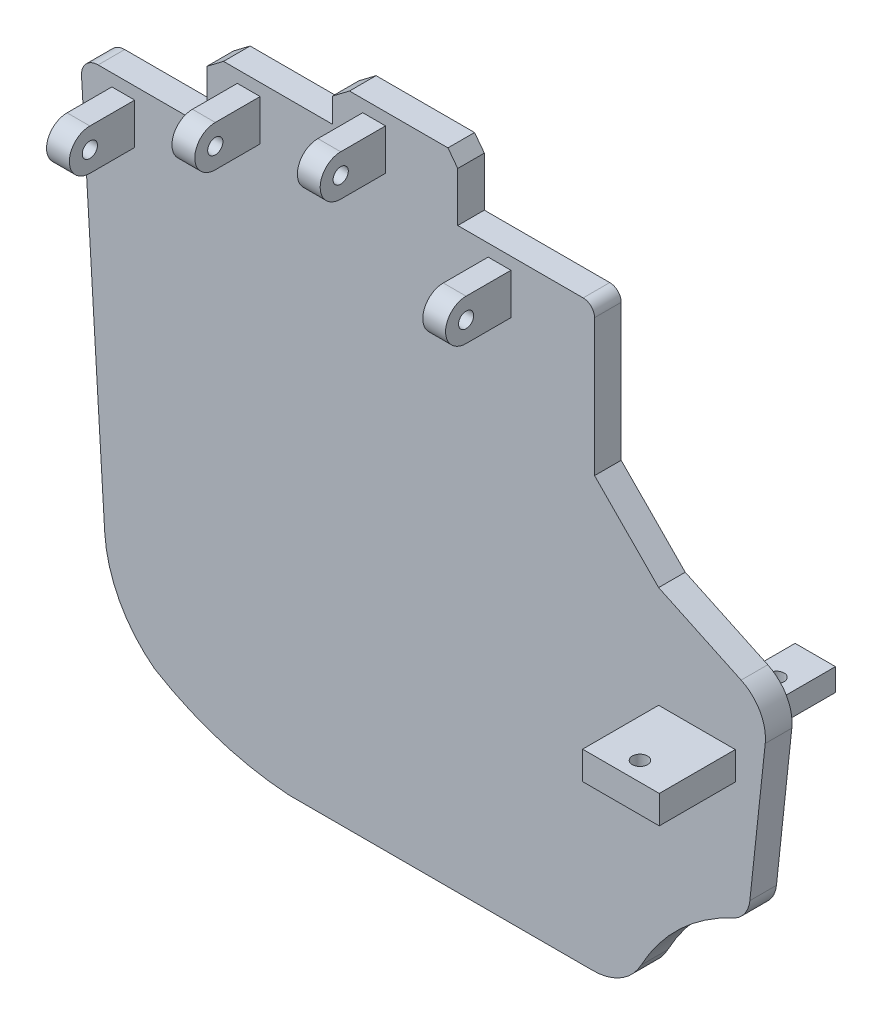
from build123d import *

# Parameters (mm, degrees)
BOSS_EXTRUDE1_DEPTH   = 3.5
SKETCH2_W             = 3
SKETCH2_H             = 5.4
BOSS_EXTRUDE2_DEPTH   = 8.6
BOSS_EXTRUDE2_2_DEPTH = 8.6
BOSS_EXTRUDE2_3_DEPTH = 8.6
BOSS_EXTRUDE2_4_DEPTH = 8.6
FILLET1_RADIUS        = 2.7
FILLET1_LENGTH        = 3
SKETCH3_R             = 1
CUT_EXTRUDE1_DEPTH    = 8.6
FILLET2_RADIUS        = 2.7
FILLET2_LENGTH        = 3
FILLET3_RADIUS        = 2.7
FILLET3_LENGTH        = 3
FILLET4_RADIUS        = 2.7
FILLET4_LENGTH        = 3
SKETCH4_R             = 1
CUT_EXTRUDE2_DEPTH    = 8.6
SKETCH5_R             = 1
CUT_EXTRUDE3_DEPTH    = 8.6
SKETCH6_R             = 1
CUT_EXTRUDE4_DEPTH    = 8.6
SKETCH7_W             = 10.088041161
SKETCH7_H             = 3.698948425
BOSS_EXTRUDE3_DEPTH   = 10
SKETCH9_W             = 5.309014269
SKETCH9_H             = 2.949452372
BOSS_EXTRUDE4_DEPTH   = 10
SKETCH10_R            = 1
CUT_EXTRUDE5_DEPTH    = 80.588500555
SKETCH11_R            = 1
CUT_EXTRUDE6_DEPTH    = 36


with BuildPart() as part:
    # Sketch1 → Boss-Extrude1 (new body)
    with BuildSketch(Plane.XY):
        with BuildLine():
            Line((0, 0), (40, 0))
            ThreePointArc((40, 0), (43.702860631, 1.02313584), (46.355122404, 3.802252838))
            ThreePointArc((46.355122404, 3.802252838), (51.476523904, 10.489381564), (58.451995118, 15.210530288))
            ThreePointArc((58.451995118, 15.210530288), (59.958649091, 16.457862213), (60.65507251, 18.285658031))
            Line((60.65507251, 18.285658031), (62.676036693, 37.205672289))
            ThreePointArc((62.676036693, 37.205672289), (61.992272805, 40.530891279), (59.507328539, 42.843825863))
            Line((59.507328539, 42.843825863), (48.652081527, 47.958863722))
            Line((48.652081527, 47.958863722), (40.223025169, 56.5))
            Line((40.223025169, 56.5), (40.223025169, 74.5))
            ThreePointArc((40.223025169, 74.5), (39.783685341, 75.560660172), (38.723025169, 76))
            Line((38.723025169, 76), (22.223025169, 76))
            Line((22.223025169, 76), (22.223025169, 82.5))
            Line((22.223025169, 82.5), (20.933955052, 84.202172899))
            Line((20.933955052, 84.202172899), (7.977740221, 84.202172899))
            Line((7.977740221, 84.202172899), (5.723025169, 82.494657876))
            Line((5.723025169, 82.494657876), (5.723025169, 79.294657876))
            Line((5.723025169, 79.294657876), (-8.593770284, 79.294657876))
            Line((-8.593770284, 79.294657876), (-10.776974831, 77.641298372))
            Line((-10.776974831, 77.641298372), (-10.776974831, 70.641298372))
            Line((-10.776974831, 70.641298372), (-25.093770284, 70.641298372))
            ThreePointArc((-25.093770284, 70.641298372), (-26.686352367, 69.953270921), (-27.276974831, 68.32205525))
            Line((-27.276974831, 68.32205525), (-24.222625674, 17.823537539))
            ThreePointArc((-24.222625674, 17.823537539), (-22.27885064, 10.959272595), (-17.644671543, 5.535180163))
            ThreePointArc((-17.644671543, 5.535180163), (-9.153938091, 1.710530722), (0, 0))
        make_face()
    extrude(amount=BOSS_EXTRUDE1_DEPTH)

    # Sketch7 → Boss-Extrude3 (add)
    with BuildSketch(Plane.XY.offset(3.5)):
        with Locations((53.693991646, 32.699391902)):
            Rectangle(SKETCH7_W, SKETCH7_H)
    extrude(amount=BOSS_EXTRUDE3_DEPTH)

    # Sketch9 → Boss-Extrude4 (add)
    with BuildSketch(Plane(origin=(0, 0, 0), x_dir=(-1, 0, 0), z_dir=(0, 0, -1))):
        with Locations((-55.761247102, 35.612291232)):
            Rectangle(SKETCH9_W, SKETCH9_H)
    extrude(amount=BOSS_EXTRUDE4_DEPTH)

    # Sketch10 → Cut-Extrude5 (cut, through all)
    with BuildSketch(Plane(origin=(0, 37.087017418, 0), x_dir=(1, 0, 0), z_dir=(0, 1, 0))):
        with Locations(Location((55.761247101, 4.9, 0), (0, 0, 270))):
            Circle(SKETCH10_R)
    extrude(amount=-CUT_EXTRUDE5_DEPTH, mode=Mode.SUBTRACT)

    # Sketch11 → Cut-Extrude6 (cut)
    with BuildSketch(Plane(origin=(0, 34.548866114, 0), x_dir=(1, 0, 0), z_dir=(0, 1, 0))):
        with Locations(Location((53.693991645, -11, 0), (0, 0, 270))):
            Circle(SKETCH11_R)
    extrude(amount=-CUT_EXTRUDE6_DEPTH, mode=Mode.SUBTRACT)


with BuildPart() as body_2:
    # Sketch2 → Boss-Extrude2 (new body)
    with BuildSketch(Plane.XY.offset(3.5)):
        with Locations((-21.776974831, 66.341298372)):
            Rectangle(SKETCH2_W, SKETCH2_H)
    extrude(amount=BOSS_EXTRUDE2_DEPTH)

    # Fillet1: full round fillet: the end face becomes a half cylinder, R = half its width
    fillet1_face = Plane((-21.776974831, 66.341298372, 12.1), x_dir=(-1, 0, 0), z_dir=(0, 0, 1))  # on the end face: x along it, z out of the body
    fillet1_slab = fillet1_face.offset(-FILLET1_RADIUS / 2) * Box(FILLET1_LENGTH, 2 * FILLET1_RADIUS, FILLET1_RADIUS, mode=Mode.PRIVATE)  # the body's end, R deep
    fillet1_round = Plane((-21.776974831, 66.341298372, 9.4), x_dir=(0, 0, 1), z_dir=(-1, 0, 0)) * Cylinder(FILLET1_RADIUS, FILLET1_LENGTH, mode=Mode.PRIVATE)  # its axis R under the face
    add(fillet1_slab - fillet1_round, mode=Mode.SUBTRACT)

    # Sketch3 → Cut-Extrude1 (cut)
    with BuildSketch(Plane.ZY.offset(23.276974831)):
        with Locations((9.4, 66.341298372)):
            Circle(SKETCH3_R)
    extrude(amount=-CUT_EXTRUDE1_DEPTH, mode=Mode.SUBTRACT)


with BuildPart() as body_3:
    # Sketch2 → Boss-Extrude2 2 (new body)
    with BuildSketch(Plane.XY.offset(3.5)):
        with Locations((-5.276974831, 74.994657876)):
            Rectangle(SKETCH2_W, SKETCH2_H)
    extrude(amount=BOSS_EXTRUDE2_2_DEPTH)

    # Fillet2: full round fillet: the end face becomes a half cylinder, R = half its width
    fillet2_face = Plane((-5.276974831, 74.994657876, 12.1), x_dir=(-1, 0, 0), z_dir=(0, 0, 1))  # on the end face: x along it, z out of the body
    fillet2_slab = fillet2_face.offset(-FILLET2_RADIUS / 2) * Box(FILLET2_LENGTH, 2 * FILLET2_RADIUS, FILLET2_RADIUS, mode=Mode.PRIVATE)  # the body's end, R deep
    fillet2_round = Plane((-5.276974831, 74.994657876, 9.4), x_dir=(0, 0, 1), z_dir=(-1, 0, 0)) * Cylinder(FILLET2_RADIUS, FILLET2_LENGTH, mode=Mode.PRIVATE)  # its axis R under the face
    add(fillet2_slab - fillet2_round, mode=Mode.SUBTRACT)

    # Sketch4 → Cut-Extrude2 (cut)
    with BuildSketch(Plane.ZY.offset(6.776974831)):
        with Locations(Location((9.4, 74.994657876, 0), (0, 0, 270))):
            Circle(SKETCH4_R)
    extrude(amount=-CUT_EXTRUDE2_DEPTH, mode=Mode.SUBTRACT)


with BuildPart() as body_4:
    # Sketch2 → Boss-Extrude2 3 (new body)
    with BuildSketch(Plane.XY.offset(3.5)):
        with Locations((11.223025169, 79.902172899)):
            Rectangle(SKETCH2_W, SKETCH2_H)
    extrude(amount=BOSS_EXTRUDE2_3_DEPTH)

    # Fillet3: full round fillet: the end face becomes a half cylinder, R = half its width
    fillet3_face = Plane((11.223025169, 79.902172899, 12.1), x_dir=(-1, 0, 0), z_dir=(0, 0, 1))  # on the end face: x along it, z out of the body
    fillet3_slab = fillet3_face.offset(-FILLET3_RADIUS / 2) * Box(FILLET3_LENGTH, 2 * FILLET3_RADIUS, FILLET3_RADIUS, mode=Mode.PRIVATE)  # the body's end, R deep
    fillet3_round = Plane((11.223025169, 79.902172899, 9.4), x_dir=(0, 0, 1), z_dir=(-1, 0, 0)) * Cylinder(FILLET3_RADIUS, FILLET3_LENGTH, mode=Mode.PRIVATE)  # its axis R under the face
    add(fillet3_slab - fillet3_round, mode=Mode.SUBTRACT)

    # Sketch5 → Cut-Extrude3 (cut)
    with BuildSketch(Plane.ZY.offset(-9.723025169)):
        with Locations((9.4, 79.902172899)):
            Circle(SKETCH5_R)
    extrude(amount=-CUT_EXTRUDE3_DEPTH, mode=Mode.SUBTRACT)


with BuildPart() as body_5:
    # Sketch2 → Boss-Extrude2 4 (new body)
    with BuildSketch(Plane.XY.offset(3.5)):
        with Locations((27.723025169, 71.7)):
            Rectangle(SKETCH2_W, SKETCH2_H)
    extrude(amount=BOSS_EXTRUDE2_4_DEPTH)

    # Fillet4: full round fillet: the end face becomes a half cylinder, R = half its width
    fillet4_face = Plane((27.723025169, 71.7, 12.1), x_dir=(-1, 0, 0), z_dir=(0, 0, 1))  # on the end face: x along it, z out of the body
    fillet4_slab = fillet4_face.offset(-FILLET4_RADIUS / 2) * Box(FILLET4_LENGTH, 2 * FILLET4_RADIUS, FILLET4_RADIUS, mode=Mode.PRIVATE)  # the body's end, R deep
    fillet4_round = Plane((27.723025169, 71.7, 9.4), x_dir=(0, 0, 1), z_dir=(-1, 0, 0)) * Cylinder(FILLET4_RADIUS, FILLET4_LENGTH, mode=Mode.PRIVATE)  # its axis R under the face
    add(fillet4_slab - fillet4_round, mode=Mode.SUBTRACT)

    # Sketch6 → Cut-Extrude4 (cut)
    with BuildSketch(Plane.ZY.offset(-26.223025169)):
        with Locations(Location((9.4, 71.7, 0), (0, 0, 270))):
            Circle(SKETCH6_R)
    extrude(amount=-CUT_EXTRUDE4_DEPTH, mode=Mode.SUBTRACT)


solid = Compound([part.part, body_2.part, body_3.part, body_4.part, body_5.part])
